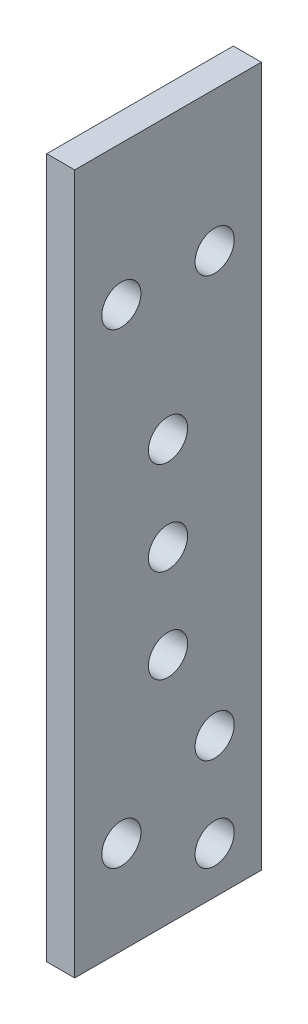
from build123d import *

# Parameters (mm, degrees)
SKETCH_1_W      = 75
SKETCH_1_H      = 20
SKETCH_1_R      = 2.1
EXTRUDE_1_DEPTH = 3


with BuildPart() as part:
    # 草图1 → 凸台-拉伸1 (new body)
    with BuildSketch(Plane(origin=(36, 0, 0), x_dir=(0, -1, 0), z_dir=(-1, 0, 0))):
        with Locations((42.5, 10)):
            Rectangle(SKETCH_1_W, SKETCH_1_H)
        with Locations(Location((20, 15, 0), (0, 0, 270))):
            Circle(SKETCH_1_R, mode=Mode.SUBTRACT)
        with Locations(Location((55, 10, 0), (0, 0, 270))):
            Circle(SKETCH_1_R, mode=Mode.SUBTRACT)
        with Locations(Location((45, 10, 0), (0, 0, 270))):
            Circle(SKETCH_1_R, mode=Mode.SUBTRACT)
        with Locations(Location((35, 10, 0), (0, 0, 270))):
            Circle(SKETCH_1_R, mode=Mode.SUBTRACT)
        with Locations(Location((20, 5, 0), (0, 0, 270))):
            Circle(SKETCH_1_R, mode=Mode.SUBTRACT)
        with Locations(Location((75, 5, 0), (0, 0, 270))):
            Circle(SKETCH_1_R, mode=Mode.SUBTRACT)
        with Locations(Location((70, 15, 0), (0, 0, 270))):
            Circle(SKETCH_1_R, mode=Mode.SUBTRACT)
        with Locations(Location((65, 5, 0), (0, 0, 270))):
            Circle(SKETCH_1_R, mode=Mode.SUBTRACT)
    extrude(amount=-EXTRUDE_1_DEPTH)


solid = part.part
